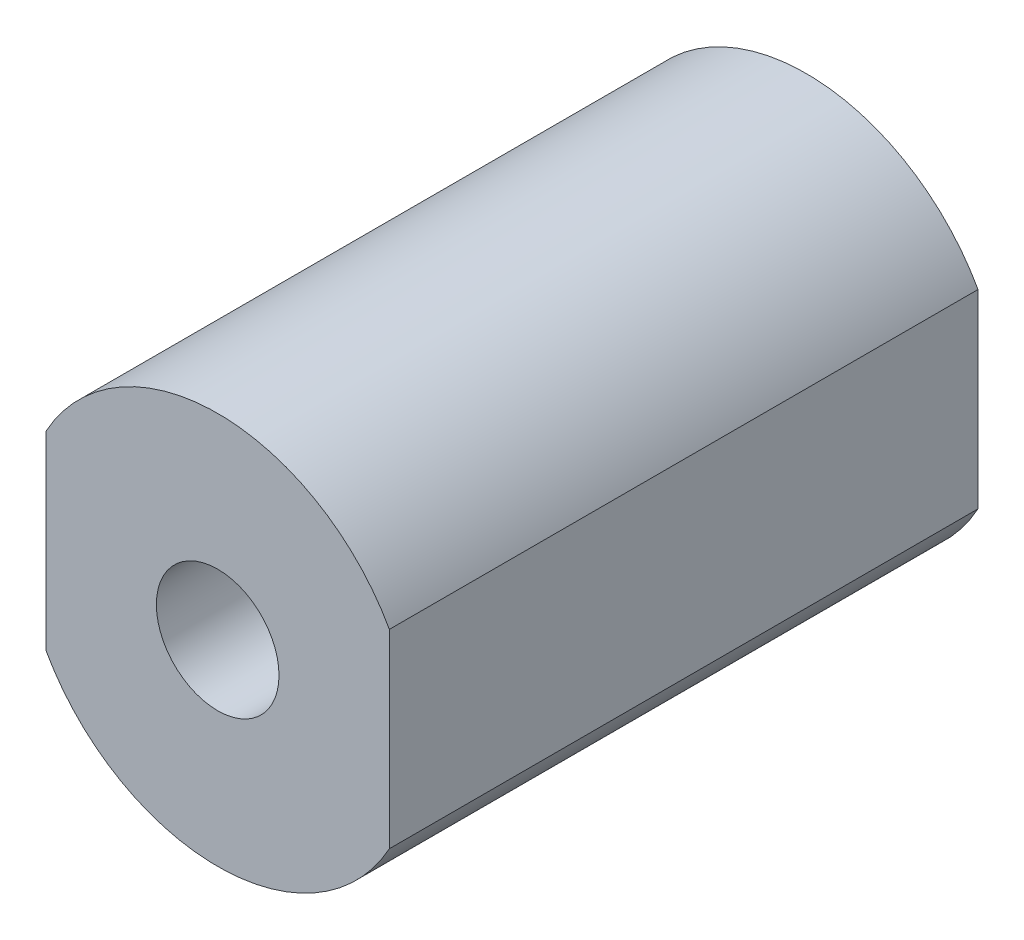
from build123d import *

# Parameters (mm, degrees)
SKETCH1_R           = 1.25
BOSS_EXTRUDE1_DEPTH = 12
SKETCH3_R           = 1.25
BOSS_EXTRUDE2_DEPTH = 0.3


with BuildPart() as part:
    # Sketch1 → Boss-Extrude1 (new body)
    with BuildSketch(Plane.XY):
        with BuildLine():
            Line((3.5, 1.936491673), (3.5, -1.936491673))
            ThreePointArc((3.5, -1.936491673), (0, -4), (-3.5, -1.936491673))
            Line((-3.5, -1.936491673), (-3.5, 1.936491673))
            ThreePointArc((-3.5, 1.936491673), (0, 4), (3.5, 1.936491673))
        make_face()
        Circle(SKETCH1_R, mode=Mode.SUBTRACT)
    extrude(amount=BOSS_EXTRUDE1_DEPTH)

    # Sketch3 → Boss-Extrude2 (add)
    with BuildSketch(Plane(origin=(0, 0, 0), x_dir=(-1, 0, 0), z_dir=(0, 0, -1))):
        Circle(SKETCH3_R)
    extrude(amount=-BOSS_EXTRUDE2_DEPTH)


solid = part.part
